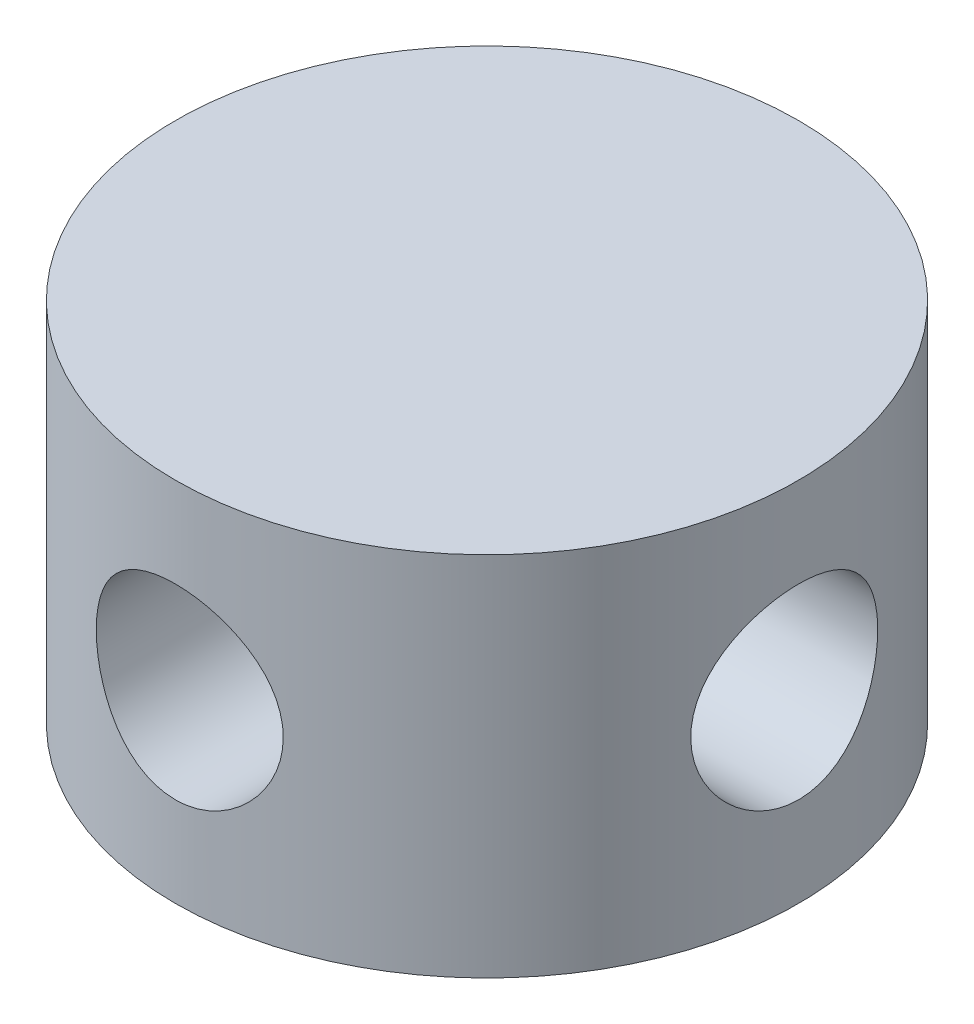
from build123d import *

# Parameters (mm, degrees)
CIRKEL_R                   = 17
CILINDER_DEPTH             = 20
CIRKEL_GAT_R               = 5.1
OPENING_DEPTH              = 10
GATEN_PATROON_COUNT        = 4
CIRKEL1_R                  = 13.5
OPENING_OPZET_DEPTH        = 3
CIRKEL2_R                  = 1.9
GAT_VERLOOPSTUK_DEPTH      = 8
CIRKEL3_R                  = 2.9
GAT_VERLOOPSTUK_RAND_DEPTH = 2


with BuildPart() as part:
    # cirkel → cilinder (new body)
    with BuildSketch(Plane(origin=(0, 0, 0), x_dir=(1, 0, 0), z_dir=(0, 1, 0))):
        with Locations(Location((0, 0, 0), (0, 0, 270))):
            Circle(CIRKEL_R)
    extrude(amount=CILINDER_DEPTH)

    # cirkel_gat → opening (cut)
    with BuildSketch(Plane.XY.offset(17)):
        with Locations((0, 10)):
            Circle(CIRKEL_GAT_R)
    opening = extrude(amount=-OPENING_DEPTH, mode=Mode.SUBTRACT)

    # gaten_patroon: opening ×4 about axis
    gaten_patroon_axis = Axis((0, 0, 0), (0, 1, 0))
    for i in range(1, GATEN_PATROON_COUNT):
        add(opening.rotate(gaten_patroon_axis, i * 360 / GATEN_PATROON_COUNT), mode=Mode.SUBTRACT)

    # cirkel1 → opening_opzet (cut)
    with BuildSketch(Plane(origin=(0, 0, 0), x_dir=(-1, 0, 0), z_dir=(0, -1, 0))):
        with Locations(Location((0, 0, 0), (0, 0, 90))):
            Circle(CIRKEL1_R)
    extrude(amount=-OPENING_OPZET_DEPTH, mode=Mode.SUBTRACT)

    # cirkel2 → gat_verloopstuk (cut)
    with BuildSketch(Plane(origin=(0, 3, 0), x_dir=(-1, 0, 0), z_dir=(0, -1, 0))):
        with Locations(Location((0, 0, 0), (0, 0, 90))):
            Circle(CIRKEL2_R)
    extrude(amount=-GAT_VERLOOPSTUK_DEPTH, mode=Mode.SUBTRACT)

    # cirkel3 → gat_verloopstuk_rand (cut)
    with BuildSketch(Plane.XZ.offset(-3)):
        with Locations(Location((0, 0, 0), (0, 0, 270))):
            Circle(CIRKEL3_R)
    extrude(amount=-GAT_VERLOOPSTUK_RAND_DEPTH, mode=Mode.SUBTRACT)


solid = part.part
